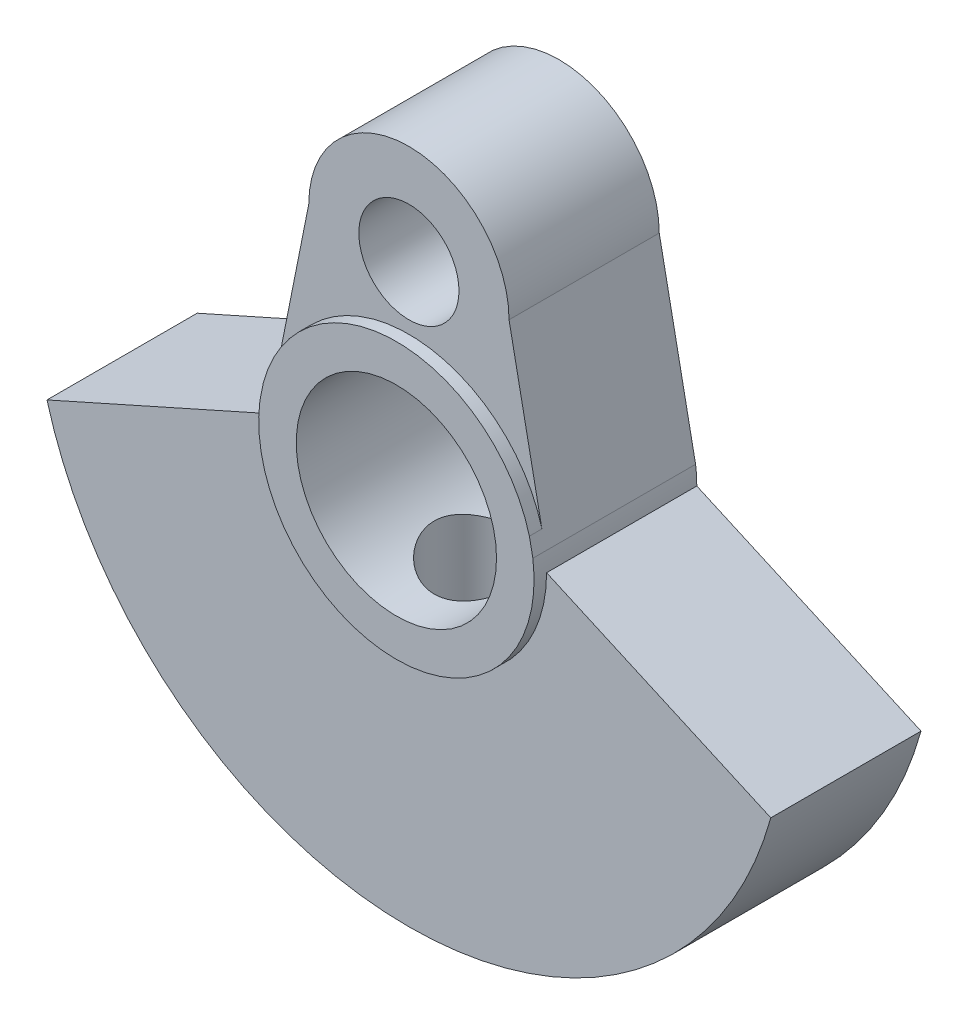
from build123d import *

# Parameters (mm, degrees)
BOSS_EXTRUDE1_DEPTH          = 3
SKETCH1_R                    = 2
BOSS_EXTRUDE1_2_DEPTH        = 3
BOSS_EXTRUDE4_START          = 3.5
BOSS_EXTRUDE4_DEPTH          = 6.5
F_4_0_4_DIAMETER_HOLE1_D     = 4
F_4_0_4_DIAMETER_HOLE1_DEPTH = 15


with BuildPart() as part:
    # Sketch1 → Boss-Extrude1 (new, symmetric)
    with BuildSketch(Plane.XY):
        with BuildLine():
            Line((-5.5, 0), (-14.456832294800959, -4))
            ThreePointArc((-14.45683229480096, -4.000000000000001), (1.78e-15, -15), (14.456832294800964, -4))
            Line((14.456832294800959, -4), (5.5, 0))
            ThreePointArc((5.5, -1.35e-15), (3.8890872965259793, -3.8890872965260432), (-8.406e-14, -5.5))
            ThreePointArc((-8.406e-14, -5.5), (-3.8890872965260415, -3.8890872965259815), (-5.5, 6.7e-16))
        make_face()
    extrude(amount=BOSS_EXTRUDE1_DEPTH, both=True)



with BuildPart() as body_2:
    # Sketch1 → Boss-Extrude1 2 (new, symmetric)
    with BuildSketch(Plane.XY):
        with BuildLine():
            Line((-4, 8), (-5.313044131475103, 1.4218164638932054))
            ThreePointArc((-5.313044131475121, 1.4218164638932076), (-6.7e-16, 5.5), (5.313044131475121, 1.421816463893209))
            Line((5.313044131475103, 1.4218164638932063), (4, 8))
            ThreePointArc((4, 8), (2e-17, 12), (-4, 8))
        make_face()
        with Locations((8.9e-16, 8)):
            Circle(SKETCH1_R, mode=Mode.SUBTRACT)
    extrude(amount=BOSS_EXTRUDE1_2_DEPTH, both=True)


with BuildPart() as part_1:
    add(part.part)

    add(body_2.part)  # Boss-Extrude4 merges body 2
    # Sketch1<5> → Boss-Extrude4 (add)
    with BuildSketch(Plane.XY.offset(BOSS_EXTRUDE4_START)):
        with BuildLine():
            Line((0, -4), (0, -5.5))
            ThreePointArc((-8.406e-14, -5.5), (3.8890872965259793, -3.8890872965260432), (5.5, -1.35e-15))
            ThreePointArc((5.5, 0), (5.487925108620274, 0.3642499171930612), (5.45175345375449, 0.7269004605006023))
            Line((5.45175345375449, 0.7269004605006018), (5.313044131475103, 1.4218164638932063))
            ThreePointArc((5.31304413147512, 1.421816463893209), (3.348881115282156, 4.362911330259479), (-8.271e-14, 5.5))
            Line((0, 5.500000000000002), (0, 4))
            ThreePointArc((-1.2321e-13, 4), (2.8284271247461463, 2.828427124746234), (4, 0))
            ThreePointArc((4, -9.8e-16), (2.8284271247461468, -2.8284271247462334), (-1.2508e-13, -4))
        make_face()
        with BuildLine():
            ThreePointArc((-5.45175345375449, 0.7269004605006025), (-5.487925108620274, 0.36424991719306166), (-5.5, 6.7e-16))
            ThreePointArc((-5.5, 6.7e-16), (-3.8890872965260415, -3.8890872965259815), (-8.406e-14, -5.5))
            Line((0, -5.5), (0, -4))
            ThreePointArc((-1.2508e-13, -4), (-4, 4.9e-16), (-1.2321e-13, 4))
            Line((0, 4), (0, 5.500000000000002))
            ThreePointArc((-8.271e-14, 5.5), (-3.3488811152822207, 4.36291133025943), (-5.31304413147512, 1.4218164638932085))
            Line((-5.313044131475103, 1.4218164638932054), (-5.45175345375449, 0.7269004605006018))
        make_face()
    extrude(amount=-BOSS_EXTRUDE4_DEPTH)

    # Ø4.0 (4) Diameter Hole1
    with Locations(Plane(origin=(0, -15, -0.016063309), x_dir=(-1, 0, 0), z_dir=(0, -1, 0))):
        with Locations((0, 0)):
            Hole(F_4_0_4_DIAMETER_HOLE1_D / 2, depth=F_4_0_4_DIAMETER_HOLE1_DEPTH)


solid = part_1.part
